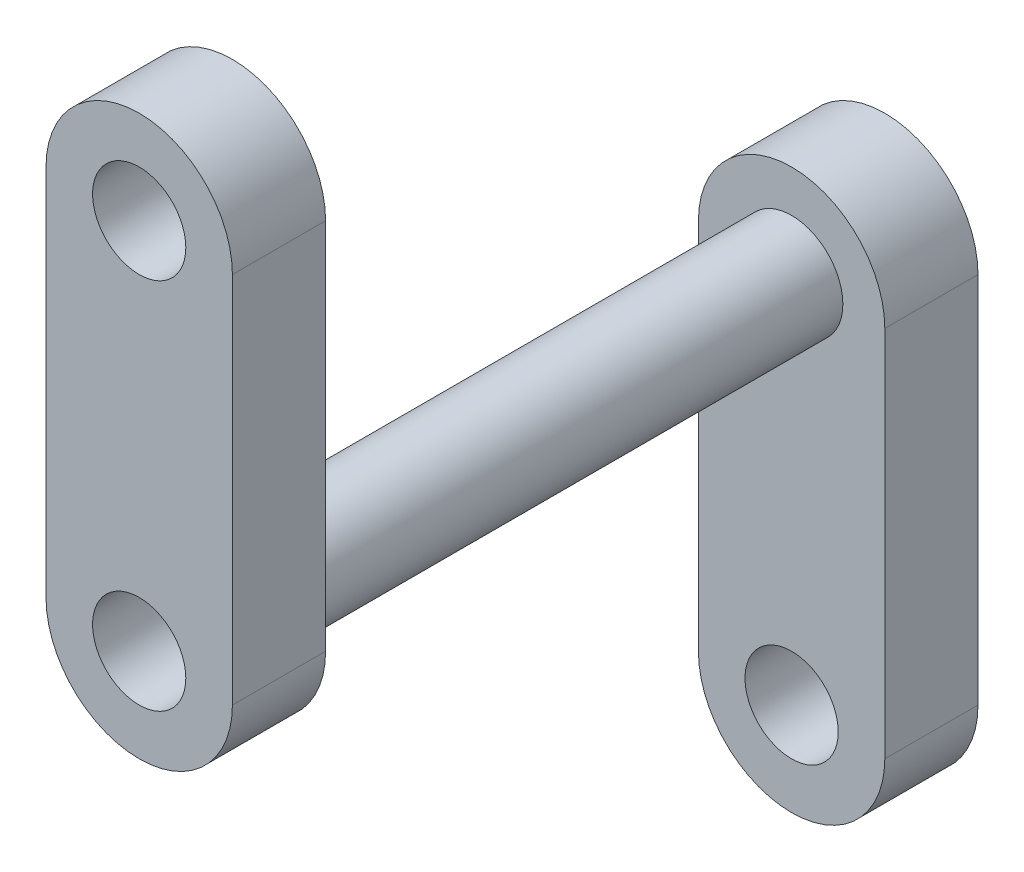
from build123d import *

# Parameters (mm, degrees)
SKETCH1_R           = 5
SKETCH1_R_2         = 5.5
BOSS_EXTRUDE1_DEPTH = 10
SKETCH1_3_R         = 5.5
SKETCH1_3_R_2       = 5
BOSS_EXTRUDE2_DEPTH = 80
BOSS_EXTRUDE3_START = -10
SKETCH2_R           = 5.5
SKETCH2_R_2         = 5
BOSS_EXTRUDE3_DEPTH = 10


with BuildPart() as part:
    # Sketch1 → Boss-Extrude1 (new body)
    with BuildSketch(Plane.XY):
        with BuildLine():
            Line((0, 50), (0, 10))
            ThreePointArc((0, 10), (10, 0), (20, 10))
            Line((20, 10), (20, 50))
            ThreePointArc((20, 50), (10, 60), (0, 50))
        make_face()
        with Locations((10, 10)):
            Circle(SKETCH1_R, mode=Mode.SUBTRACT)
        with Locations((10, 50)):
            Circle(SKETCH1_R_2, mode=Mode.SUBTRACT)
    extrude(amount=BOSS_EXTRUDE1_DEPTH)

    # Sketch1<3> → Boss-Extrude2 (add)
    with BuildSketch(Plane.XY):
        with Locations((10, 50)):
            Circle(SKETCH1_3_R)
        with Locations((10, 50)):
            Circle(SKETCH1_3_R_2, mode=Mode.SUBTRACT)
    extrude(amount=BOSS_EXTRUDE2_DEPTH)

    # Sketch2 → Boss-Extrude3 (add)
    with BuildSketch(Plane.XY.offset(80).offset(BOSS_EXTRUDE3_START)):
        with BuildLine():
            Line((20, 50), (20, 90))
            ThreePointArc((20, 90), (10, 100), (0, 90))
            Line((0, 90), (0, 50))
            ThreePointArc((0, 50), (10, 40), (20, 50))
        make_face()
        with Locations((10, 50)):
            Circle(SKETCH2_R, mode=Mode.SUBTRACT)
        with Locations((10, 90)):
            Circle(SKETCH2_R_2, mode=Mode.SUBTRACT)
    extrude(amount=BOSS_EXTRUDE3_DEPTH)


solid = part.part
